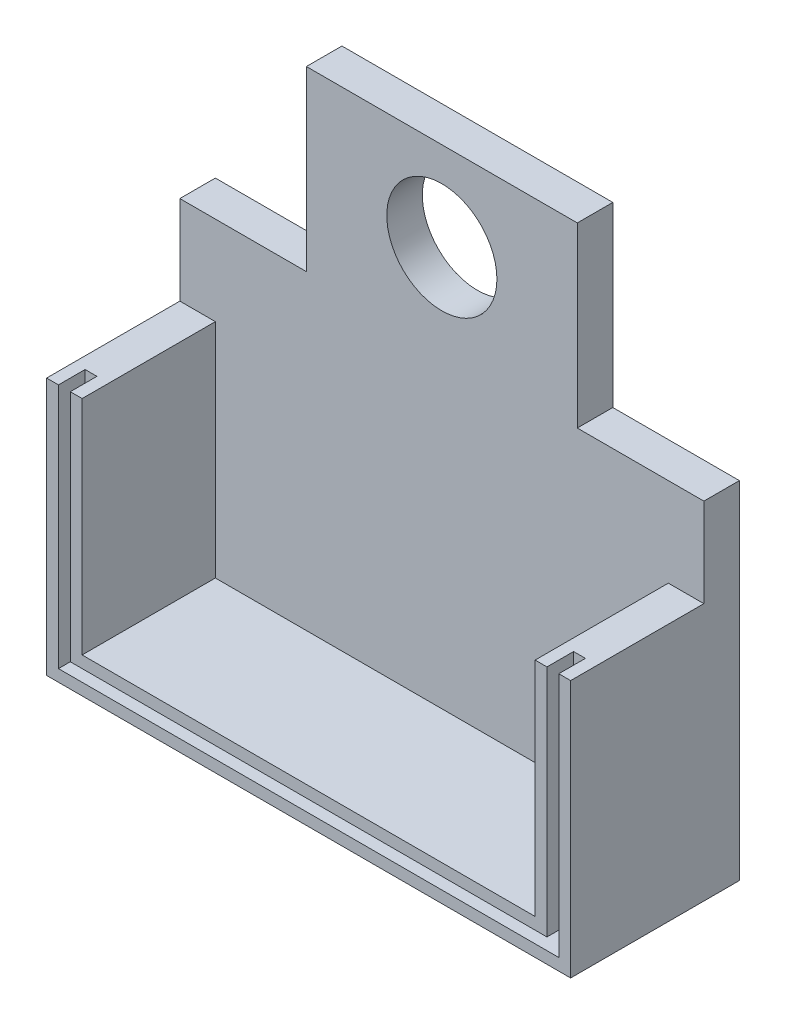
from build123d import *

# Parameters (mm, degrees)
SKETCH1_W           = 30.5
SKETCH1_H           = 20
SKETCH1_R           = 6.2
BOSS_EXTRUDE1_DEPTH = 4
SKETCH2_W           = 59
SKETCH2_H           = 4
BOSS_EXTRUDE2_DEPTH = 35
SKETCH4_W           = 59
SKETCH4_H           = 4
BOSS_EXTRUDE3_DEPTH = 4
SKETCH5_W           = 4
SKETCH5_H           = 25
BOSS_EXTRUDE4_DEPTH = 15
SKETCH6_W           = 1.333333334
SKETCH6_H           = 26.333333333
CUT_EXTRUDE1_DEPTH  = 3


with BuildPart() as part:
    # Sketch1 → Boss-Extrude1 (new body)
    with BuildSketch(Plane.XY):
        Rectangle(SKETCH1_W, SKETCH1_H)
        Circle(SKETCH1_R, mode=Mode.SUBTRACT)
    extrude(amount=BOSS_EXTRUDE1_DEPTH)

    # Sketch2 → Boss-Extrude2 (add)
    with BuildSketch(Plane.XZ.offset(10)):
        with Locations((0, 2)):
            Rectangle(SKETCH2_W, SKETCH2_H)
    extrude(amount=BOSS_EXTRUDE2_DEPTH)

    # Sketch4 → Boss-Extrude3 (add)
    with BuildSketch(Plane.XZ.offset(45)):
        with Locations((0, 2)):
            Rectangle(SKETCH4_W, SKETCH4_H)
    extrude(amount=BOSS_EXTRUDE3_DEPTH)

    # Sketch5 → Boss-Extrude4 (add)
    with BuildSketch(Plane.XY.offset(4)):
        with Locations((-27.5, -32.5)):
            Rectangle(SKETCH5_W, SKETCH5_H)
        Polygon((-29.5, -45), (-29.5, -49), (29.5, -49), (29.5, -45), (25.5, -45), (-25.5, -45), align=None)
        with Locations((27.5, -32.5)):
            Rectangle(SKETCH5_W, SKETCH5_H)
    extrude(amount=BOSS_EXTRUDE4_DEPTH)

    # Sketch6 → Cut-Extrude1 (cut)
    with BuildSketch(Plane.XY.offset(19)):
        Polygon((-26.833333333, -20), (-28.166666667, -20), (-28.166666667, -47.666666667), (-26.833333333, -47.666666667), (-26.833333333, -46.333333333), align=None)
        Polygon((26.833333333, -46.333333333), (-26.833333333, -46.333333333), (-26.833333333, -47.666666667), (28.166666667, -47.666666667), (28.166666667, -46.333333333), align=None)
        with Locations((27.5, -33.166666667)):
            Rectangle(SKETCH6_W, SKETCH6_H)
    extrude(amount=-CUT_EXTRUDE1_DEPTH, mode=Mode.SUBTRACT)


solid = part.part
